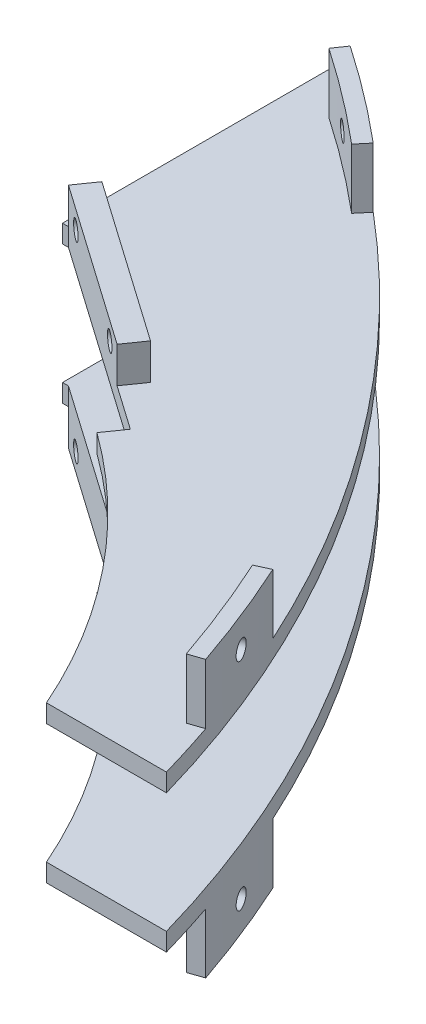
from build123d import *
from build123d.topology import SkipClean

# Parameters (mm, degrees)
BOSS_EXTRUDE1_DEPTH = 3
BOSS_EXTRUDE2_DEPTH = 6
SKETCH3_R           = 1.5
SKETCH3_W           = 9.001604742
SKETCH3_H           = 6
SKETCH3_W_2         = 4.02
CUT_EXTRUDE1_DEPTH  = 127.267442601
BOSS_EXTRUDE3_DEPTH = 3
BOSS_EXTRUDE4_START = 10
BOSS_EXTRUDE4_DEPTH = 10
SKETCH8_R           = 1.5
CUT_EXTRUDE2_DEPTH  = 128.065880874
SKETCH9_R           = 1.5
CUT_EXTRUDE3_DEPTH  = 139.749200001


with BuildPart() as part:
    # Sketch1 → Boss-Extrude1 (new body)
    with BuildSketch(Plane(origin=(0, 0, 0), x_dir=(1, 0, 0), z_dir=(0, 1, 0))):
        with BuildLine():
            Line((0, 0), (20, 0))
            ThreePointArc((20, 0), (-13.094687741, 66.050339598), (-67.91, 115.58))
            Line((-67.91, 115.58), (-67.91, 72.58))
            ThreePointArc((-67.91, 72.58), (-27.76846685, 42.078474321), (0, 0))
        make_face()
    extrude(amount=BOSS_EXTRUDE1_DEPTH)

    # Sketch2 → Boss-Extrude2 (add)
    with BuildSketch(Plane.XZ):
        Polygon((-66.91, -70.583412503), (-32.50561414, -46.493202176), (-32.50561414, -51.376300531), (-67.91, -76.166718396), (-67.91, -71.283620041), align=None)
    extrude(amount=BOSS_EXTRUDE2_DEPTH)

    # Sketch3 → Cut-Extrude1 (cut, through all)
    with BuildSketch(Plane(origin=(13.44494558, 0, -19.201372231), x_dir=(-0.8191520442889929, 0, -0.5735764363510446), z_dir=(0.5735764363510446, 0, -0.819152044288993))):
        with Locations((90.296050234, -3)):
            Circle(SKETCH3_R)
        with Locations((67.296050234, -3)):
            Circle(SKETCH3_R)
        with Locations((57.795247863, -3)):
            Rectangle(SKETCH3_W, SKETCH3_H)
        with Locations((97.306050234, -3)):
            Rectangle(SKETCH3_W_2, SKETCH3_H)
    extrude(amount=-CUT_EXTRUDE1_DEPTH, mode=Mode.SUBTRACT)

    # Sketch5 → Boss-Extrude3 (add)
    with BuildSketch(Plane(origin=(0, 0, 0), x_dir=(1, 0, 0), z_dir=(0, 1, 0))):
        with BuildLine():
            Line((-66.911314527, 70.584332945), (-67.91, 70.584332945))
            Line((-67.91, 70.584332945), (-67.91, 72.58))
            ThreePointArc((-67.91, 72.58), (-27.76846685, 42.078474321), (0, 0))
            ThreePointArc((0, 0), (-14.53687211, 23.913782415), (-34.799919885, 43.216593999))
            Line((-34.799919885, 43.216593999), (-32.50561414, 46.493202176))
            Line((-32.50561414, 46.493202176), (-66.911314527, 70.584332945))
        make_face()
    extrude(amount=BOSS_EXTRUDE3_DEPTH)

    # Sketch6 → Boss-Extrude4 (add)
    with SkipClean():  # the faces are left unmerged after this step: merging them gives an invalid solid
        with BuildSketch(Plane.XZ.offset(BOSS_EXTRUDE4_START)):
            with BuildLine():
                Line((17.009172499, -9.542271787), (14.592981256, -8.718082865))
                ThreePointArc((14.592981256, -8.718082865), (11.17200228, -17.982061111), (7.292103292, -27.06340319))
                Line((7.292103292, -27.06340319), (9.613897775, -28.124788079))
                ThreePointArc((9.613897775, -28.124788079), (13.543961948, -18.926028715), (17.009172499, -9.542271787))
            make_face()
            with BuildLine():
                Line((-43.579643128, -98.061194149), (-45.222450268, -96.107108121))
                ThreePointArc((-45.222450268, -96.107108121), (-52.938064428, -102.271010152), (-60.952223136, -108.041421776))
                Line((-60.952223136, -108.041421776), (-59.512794221, -110.149812608))
                ThreePointArc((-59.512794221, -110.149812608), (-51.395016384, -104.304792401), (-43.579643128, -98.061194149))
            make_face()
        extrude(amount=-BOSS_EXTRUDE4_DEPTH)

    # Sketch8 → Cut-Extrude2 (cut, through all)
    with SkipClean():  # the faces are left unmerged after this step: merging them gives an invalid solid
        with BuildSketch(Plane(origin=(-51.395016384, -10, -104.304792401), x_dir=(-0.7966575546498905, 0, -0.6044309229508835), z_dir=(0.6044309229508835, 0, -0.7966575546498905))):
            with Locations((0, 5)):
                Circle(SKETCH8_R)
        extrude(amount=-CUT_EXTRUDE2_DEPTH, mode=Mode.SUBTRACT)

    # Sketch9 → Cut-Extrude3 (cut, through all)
    with SkipClean():  # the faces are left unmerged after this step: merging them gives an invalid solid
        with BuildSketch(Plane(origin=(18.194331028, 0, -7.240788829), x_dir=(-0.3697637362221705, 0, -0.9291258146101751), z_dir=(0.9291258146101751, 0, -0.3697637362221705))):
            with Locations((12.576595874, -5)):
                Circle(SKETCH9_R)
        extrude(amount=-CUT_EXTRUDE3_DEPTH, mode=Mode.SUBTRACT)


with BuildPart() as body_2:
    # Mirror2: mirrored copy
    add(part.part.mirror(Plane.ZX.offset(13)))


solid = Compound([part.part, body_2.part])
